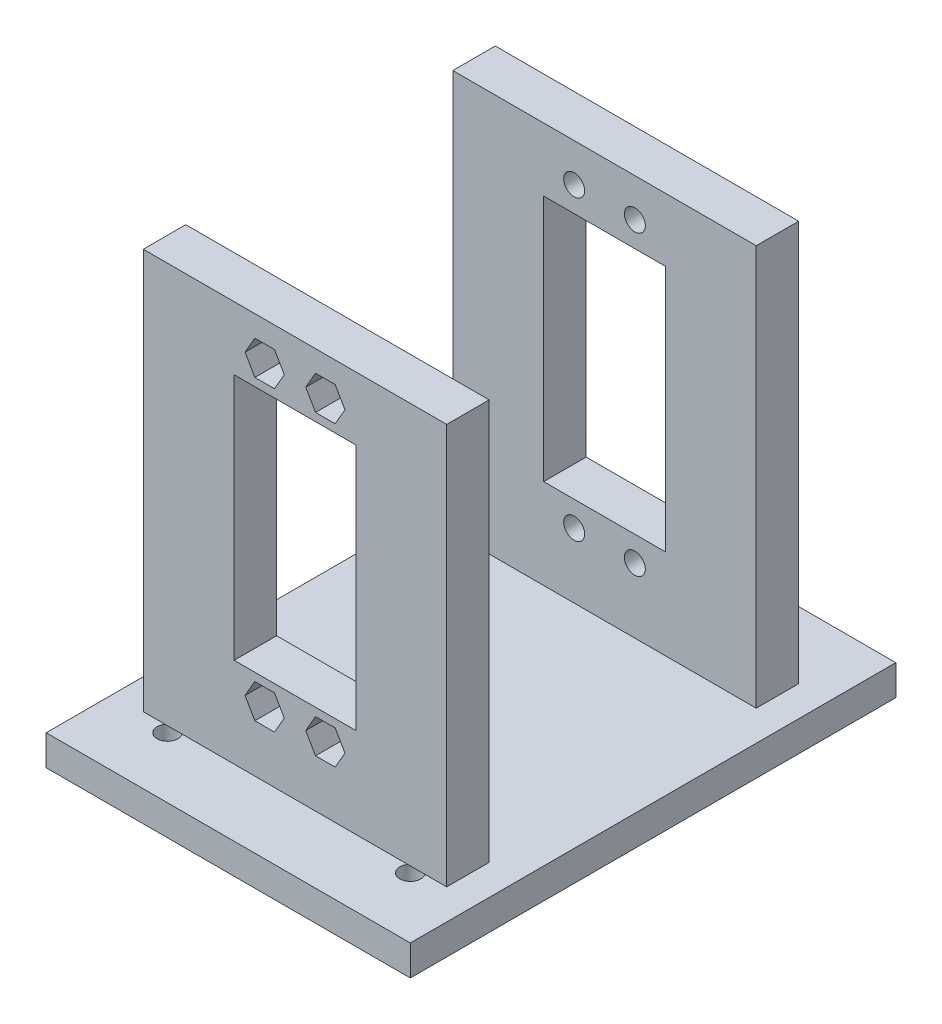
from build123d import *

# Parameters (mm, degrees)
SKETCH1_W           = 60
SKETCH1_H           = 80
BOSS_EXTRUDE1_DEPTH = 2.5
SKETCH2_R           = 1.725
CUT_EXTRUDE1_DEPTH  = 51.249378106
SKETCH3_W           = 50
SKETCH3_H           = 66
BOSS_EXTRUDE2_DEPTH = 7
SKETCH4_W           = 20.05
SKETCH4_H           = 40.75
CUT_EXTRUDE2_DEPTH  = 102.750921372
SKETCH5_R           = 1.725
CUT_EXTRUDE3_DEPTH  = 102.750921372
CUT_EXTRUDE4_DEPTH  = 4.2


with BuildPart() as part:
    # Sketch1 → Boss-Extrude1 (new, symmetric)
    with BuildSketch(Plane(origin=(0, 0, 0), x_dir=(1, 0, 0), z_dir=(0, 1, 0))):
        Rectangle(SKETCH1_W, SKETCH1_H)
    extrude(amount=BOSS_EXTRUDE1_DEPTH, both=True)

    # Sketch2 → Cut-Extrude1 (cut, through all)
    with BuildSketch(Plane(origin=(0, 2.5, 0), x_dir=(1, 0, 0), z_dir=(0, 1, 0))):
        with Locations(Location((-20, 30, 0), (0, 0, 270))):
            Circle(SKETCH2_R)
        with Locations(Location((20, 30, 0), (0, 0, 270))):
            Circle(SKETCH2_R)
        with Locations(Location((20, -30, 0), (0, 0, 270))):
            Circle(SKETCH2_R)
        with Locations(Location((-20, -30, 0), (0, 0, 270))):
            Circle(SKETCH2_R)
    extrude(amount=-CUT_EXTRUDE1_DEPTH, mode=Mode.SUBTRACT)

    # Sketch3 → Boss-Extrude2 (add)
    with BuildSketch(Plane.XY.offset(22)):
        with Locations((0, 35.5)):
            Rectangle(SKETCH3_W, SKETCH3_H)
    boss_extrude2 = extrude(amount=BOSS_EXTRUDE2_DEPTH)

    # Mirror1: Boss-Extrude2 across plane
    add(boss_extrude2.mirror(Plane.XY))

    # Sketch4 → Cut-Extrude2 (cut, through all)
    with BuildSketch(Plane.XY.offset(29)):
        with Locations((0, 37.7)):
            Rectangle(SKETCH4_W, SKETCH4_H)
    extrude(amount=-CUT_EXTRUDE2_DEPTH, mode=Mode.SUBTRACT)

    # Sketch5 → Cut-Extrude3 (cut, through all)
    with BuildSketch(Plane.XY.offset(29)):
        with Locations((-5, 62.2)):
            Circle(SKETCH5_R)
        with Locations((5, 62.2)):
            Circle(SKETCH5_R)
        with Locations((-5, 13.2)):
            Circle(SKETCH5_R)
        with Locations((5, 13.2)):
            Circle(SKETCH5_R)
    extrude(amount=-CUT_EXTRUDE3_DEPTH, mode=Mode.SUBTRACT)

    # Sketch6 → Cut-Extrude4 (cut)
    with BuildSketch(Plane.XY.offset(29)):
        Polygon((-1.766838493, 62.2), (-3.383419246, 65), (-6.616580754, 65), (-8.233161507, 62.2), (-6.616580754, 59.4), (-3.383419246, 59.4), align=None)
        Polygon((1.766838493, 62.2), (3.383419246, 59.4), (6.616580754, 59.4), (8.233161507, 62.2), (6.616580754, 65), (3.383419246, 65), align=None)
        Polygon((-1.766838493, 13.2), (-3.383419246, 16), (-6.616580754, 16), (-8.233161507, 13.2), (-6.616580754, 10.4), (-3.383419246, 10.4), align=None)
        Polygon((8.233161507, 13.2), (6.616580754, 16), (3.383419246, 16), (1.766838493, 13.2), (3.383419246, 10.4), (6.616580754, 10.4), align=None)
    cut_extrude4 = extrude(amount=-CUT_EXTRUDE4_DEPTH, mode=Mode.SUBTRACT)

    # Mirror3: Cut-Extrude4 across plane
    add(cut_extrude4.mirror(Plane.XY), mode=Mode.SUBTRACT)


solid = part.part
